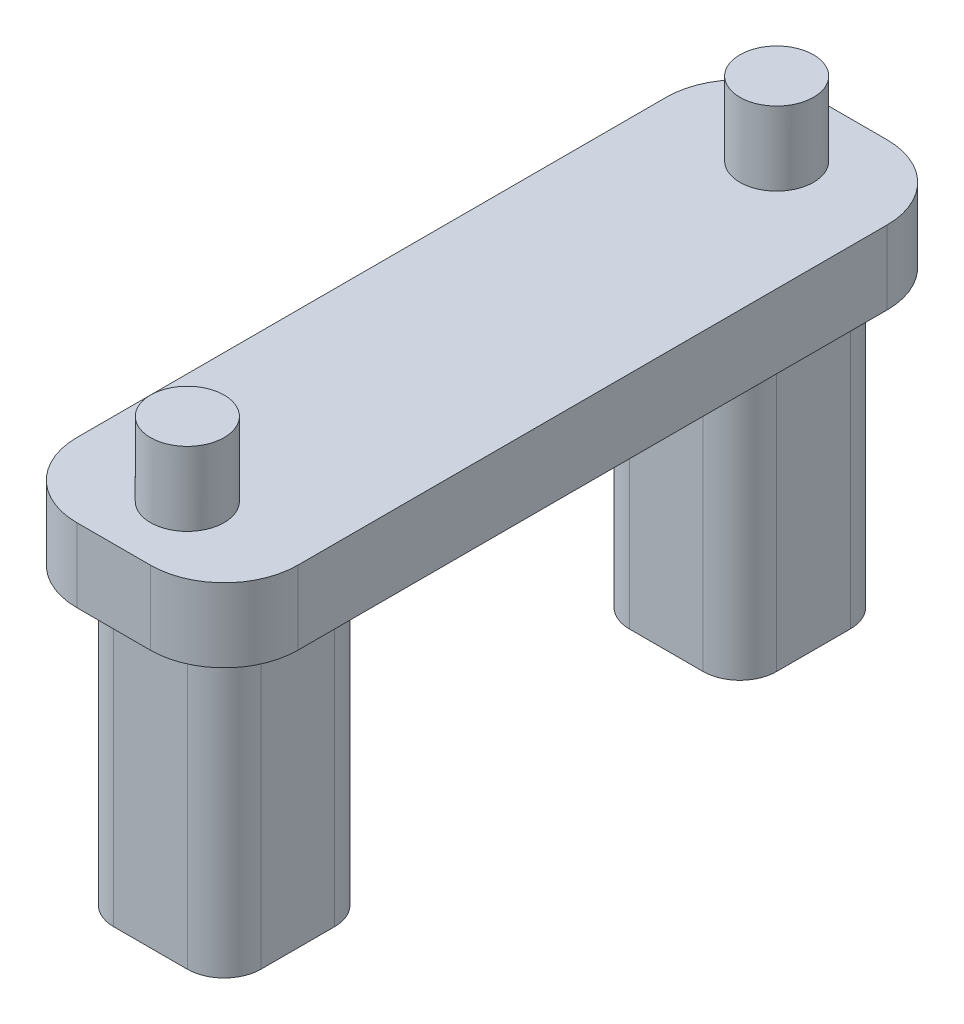
from build123d import *

# Parameters (mm, degrees)
SKETCH1_W           = 30
SKETCH1_H           = 100
BOSS_EXTRUDE1_DEPTH = 10
SKETCH2_R           = 5
BOSS_EXTRUDE2_DEPTH = 10
FILLET1_R           = 10
BOSS_EXTRUDE3_DEPTH = 40


with BuildPart() as part:
    # Sketch1 → Boss-Extrude1 (new body)
    with BuildSketch(Plane(origin=(0, 0, 0), x_dir=(1, 0, 0), z_dir=(0, 1, 0))):
        Rectangle(SKETCH1_W, SKETCH1_H)
    extrude(amount=BOSS_EXTRUDE1_DEPTH)

    # Sketch2 → Boss-Extrude2 (add)
    with BuildSketch(Plane(origin=(0, 10, 0), x_dir=(1, 0, 0), z_dir=(0, 1, 0))):
        with Locations(Location((0, 40, 0), (0, 0, 90))):
            Circle(SKETCH2_R)
        with Locations(Location((0, -40, 0), (0, 0, 90))):
            Circle(SKETCH2_R)
    extrude(amount=BOSS_EXTRUDE2_DEPTH)

    # Fillet1
    fillet1_edges = [part.edges().sort_by_distance(p)[0] for p in [
        (15, 5, 50),
        (-15, 5, 50),
        (-15, 5, -50),
        (15, 5, -50),
    ]]
    fillet(fillet1_edges, radius=FILLET1_R)

    # Sketch3 → Boss-Extrude3 (add)
    with BuildSketch(Plane.XZ):
        with BuildLine():
            Line((-10, 30), (-10, 40))
            ThreePointArc((-10, 40), (-8.535533906, 43.535533906), (-5, 45))
            Line((-5, 45), (5, 45))
            ThreePointArc((5, 45), (8.535533906, 43.535533906), (10, 40))
            Line((10, 40), (10, 30))
            ThreePointArc((10, 30), (8.535533906, 26.464466094), (5, 25))
            Line((5, 25), (-5, 25))
            ThreePointArc((-5, 25), (-8.535533906, 26.464466094), (-10, 30))
        make_face()
        with BuildLine():
            Line((5, -45), (-5, -45))
            ThreePointArc((-5, -45), (-8.535533906, -43.535533906), (-10, -40))
            Line((-10, -40), (-10, -30))
            ThreePointArc((-10, -30), (-8.535533906, -26.464466094), (-5, -25))
            Line((-5, -25), (5, -25))
            ThreePointArc((5, -25), (8.535533906, -26.464466094), (10, -30))
            Line((10, -30), (10, -40))
            ThreePointArc((10, -40), (8.535533906, -43.535533906), (5, -45))
        make_face()
    extrude(amount=BOSS_EXTRUDE3_DEPTH)


solid = part.part
